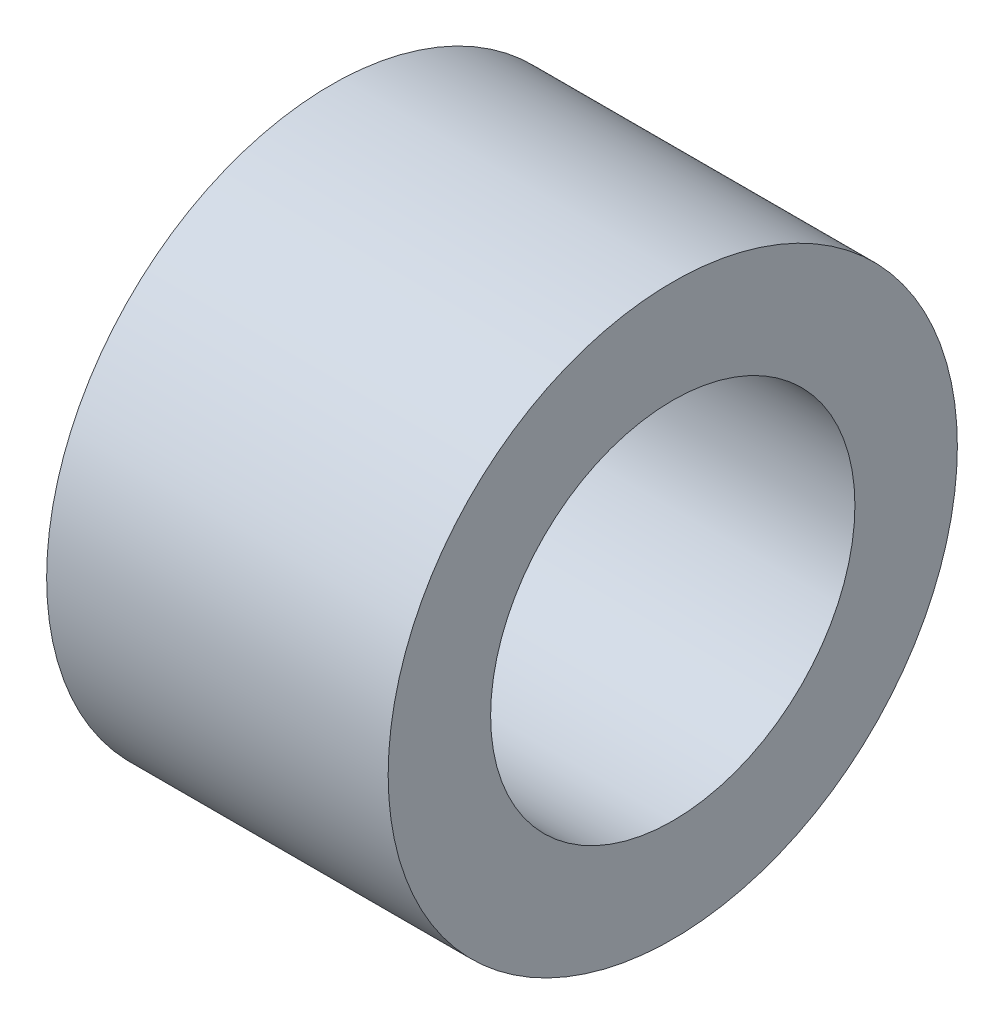
from build123d import *

# Parameters (mm, degrees)
SKIZZE1_W = 3
SKIZZE1_H = 0.9


with BuildPart() as part:
    # Skizze1 → Rotation1 (revolve)
    with BuildSketch(Plane.XY, mode=Mode.PRIVATE) as rotation1_sk:
        with Locations((1.5, 2.05)):
            Rectangle(SKIZZE1_W, SKIZZE1_H)
    revolve(rotation1_sk.sketch.rotate(Axis((0, 0, 0), (1, 0, 0)), 90), axis=Axis((0, 0, 0), (1, 0, 0)))


solid = part.part
